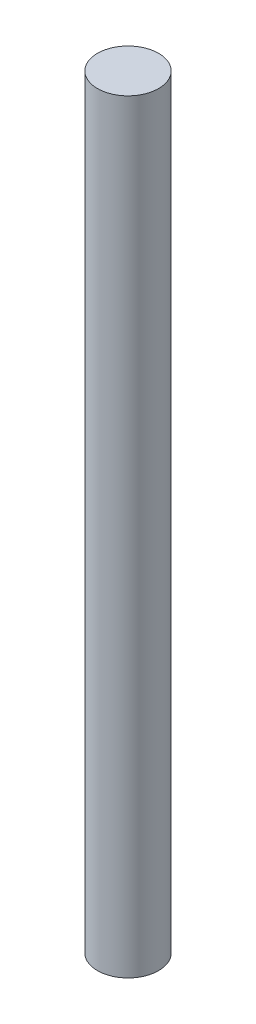
from build123d import *

# Parameters (mm, degrees)
SKETCH2_W = 10
SKETCH2_H = 250


with BuildPart() as part:
    # Sketch2 → Revolve1 (revolve)
    with BuildSketch(Plane.XY, mode=Mode.PRIVATE) as revolve1_sk:
        with Locations((-5, 125)):
            Rectangle(SKETCH2_W, SKETCH2_H)
    revolve(revolve1_sk.sketch.rotate(Axis((0, 0, 0), (0, 1, 0)), 270), axis=Axis((0, 0, 0), (0, 1, 0)))


solid = part.part
